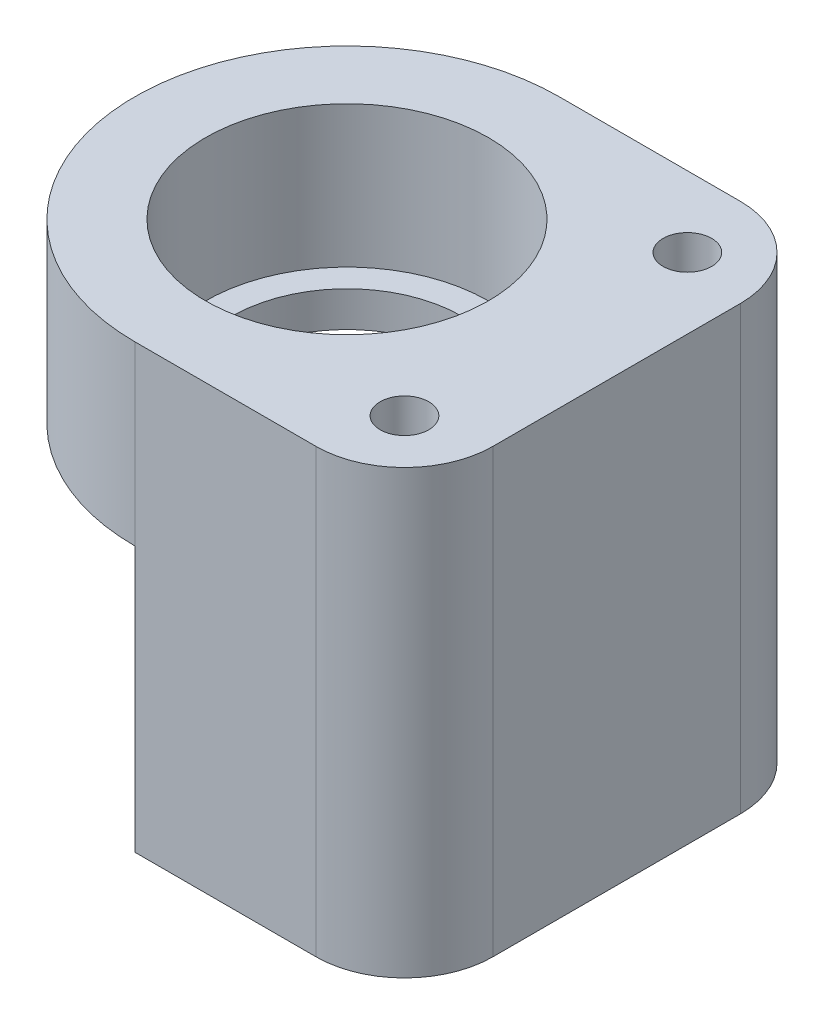
from build123d import *

# Parameters (mm, degrees)
SKETCH5_W            = 38.79143083
SKETCH5_H            = 48
CUT_EXTRUDE1_DEPTH   = 30
BOSS_EXTRUDE1_START  = -50
BOSS_EXTRUDE1_DEPTH  = 50
M5_CLEARANCE_HOLE1_D = 5.5


with BuildPart() as part:
    # Sketch1 → Revolve1 (revolve)
    with BuildSketch(Plane.XY, mode=Mode.PRIVATE) as revolve1_sk:
        Polygon((-24, 0), (-24, 50), (-16, 50), (-16, 34), (-13, 34), (-13, 30), (-16, 30), (-20, 30), (-20, 0), align=None)
    revolve(revolve1_sk.sketch.rotate(Axis((0, 0, 0), (0, 1, 0)), 270), axis=Axis((0, 0, 0), (0, 1, 0)))

    # Sketch5 → Cut-Extrude1 (cut)
    with BuildSketch(Plane(origin=(0, 0, 0), x_dir=(1, 0, 0), z_dir=(0, 1, 0))):
        with Locations((-19.395715415, 0)):
            Rectangle(SKETCH5_W, SKETCH5_H)
    extrude(amount=CUT_EXTRUDE1_DEPTH, mode=Mode.SUBTRACT)

    # Sketch6 → Boss-Extrude1 (add)
    with BuildSketch(Plane(origin=(0, 50, 0), x_dir=(1, 0, 0), z_dir=(0, 1, 0)).offset(BOSS_EXTRUDE1_START)):
        with BuildLine():
            Line((0, -24), (20.5, -24))
            ThreePointArc((20.5, -24), (27.571067812, -21.071067812), (30.5, -14))
            Line((30.5, -14), (30.5, 14))
            ThreePointArc((30.5, 14), (27.571067812, 21.071067812), (20.5, 24))
            Line((20.5, 24), (0, 24))
            ThreePointArc((0, 24), (24, 0), (0, -24))
        make_face()
    extrude(amount=BOSS_EXTRUDE1_DEPTH)

    # M5 Clearance Hole1 (through all)
    with Locations(Plane(origin=(0, 0, 0), x_dir=(-1, 0, 0), z_dir=(0, -1, 0))):
        with Locations((-22.5, -16), (-22.5, 16)):
            Hole(M5_CLEARANCE_HOLE1_D / 2)


solid = part.part
